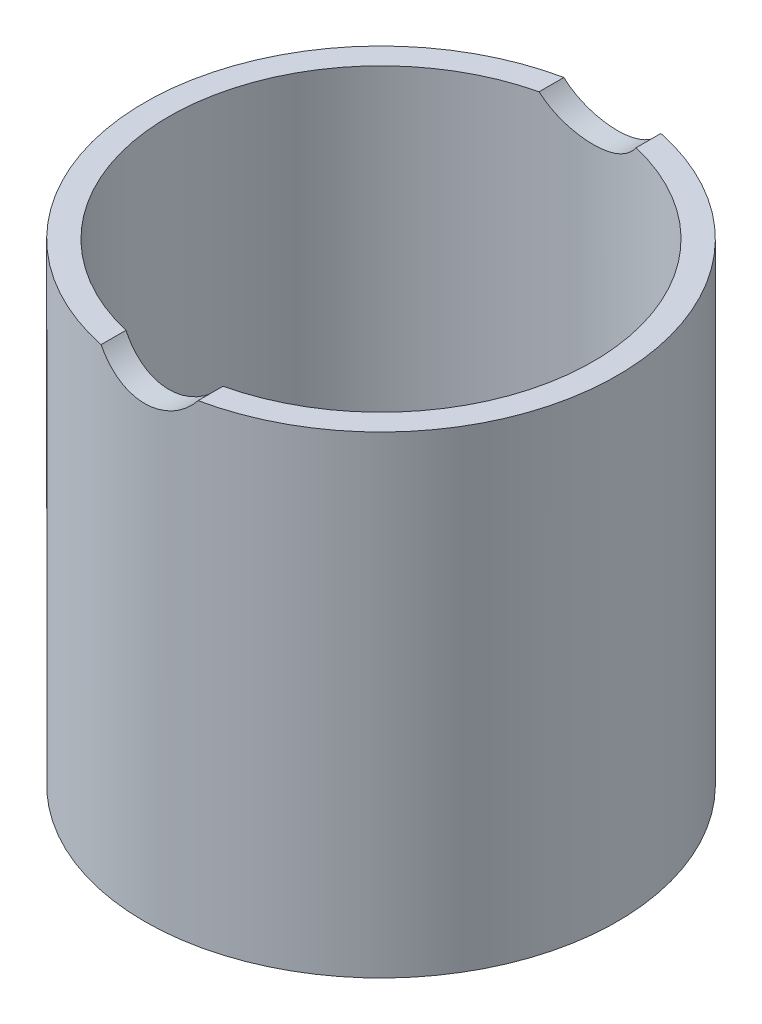
from build123d import *

# Parameters (mm, degrees)
SKETCH1_R               = 19.5
SKETCH1_R_2             = 17.5
BOSS_EXTRUDE1_DEPTH     = 37
BOSS_EXTRUDE2_START     = -2
SKETCH1_2_R             = 19.5
BOSS_EXTRUDE2_DEPTH     = 2
CUT_EXTRUDE1_DEPTH      = 47.146505827
CUT_EXTRUDE1_DEPTH_BACK = 47.146505827
SKETCH2_R               = 5


with BuildPart() as part:
    # Sketch1 → Boss-Extrude1 (new body)
    with BuildSketch(Plane(origin=(0, 0, 0), x_dir=(1, 0, 0), z_dir=(0, 1, 0))):
        Circle(SKETCH1_R)
        Circle(SKETCH1_R_2, mode=Mode.SUBTRACT)
    extrude(amount=BOSS_EXTRUDE1_DEPTH)

    # Sketch1<2> → Boss-Extrude2 (add)
    with BuildSketch(Plane(origin=(0, 0, 0), x_dir=(1, 0, 0), z_dir=(0, 1, 0)).offset(BOSS_EXTRUDE2_START)):
        Circle(SKETCH1_2_R)
    extrude(amount=BOSS_EXTRUDE2_DEPTH)

    # Sketch2 → Cut-Extrude1 (cut, two sides: drawn at the far end of the back side and taken through both)
    with BuildSketch(Plane.XY.offset(-CUT_EXTRUDE1_DEPTH_BACK)):
        with Locations((0, 40)):
            Circle(SKETCH2_R)
    extrude(amount=CUT_EXTRUDE1_DEPTH + CUT_EXTRUDE1_DEPTH_BACK, mode=Mode.SUBTRACT)


solid = part.part
